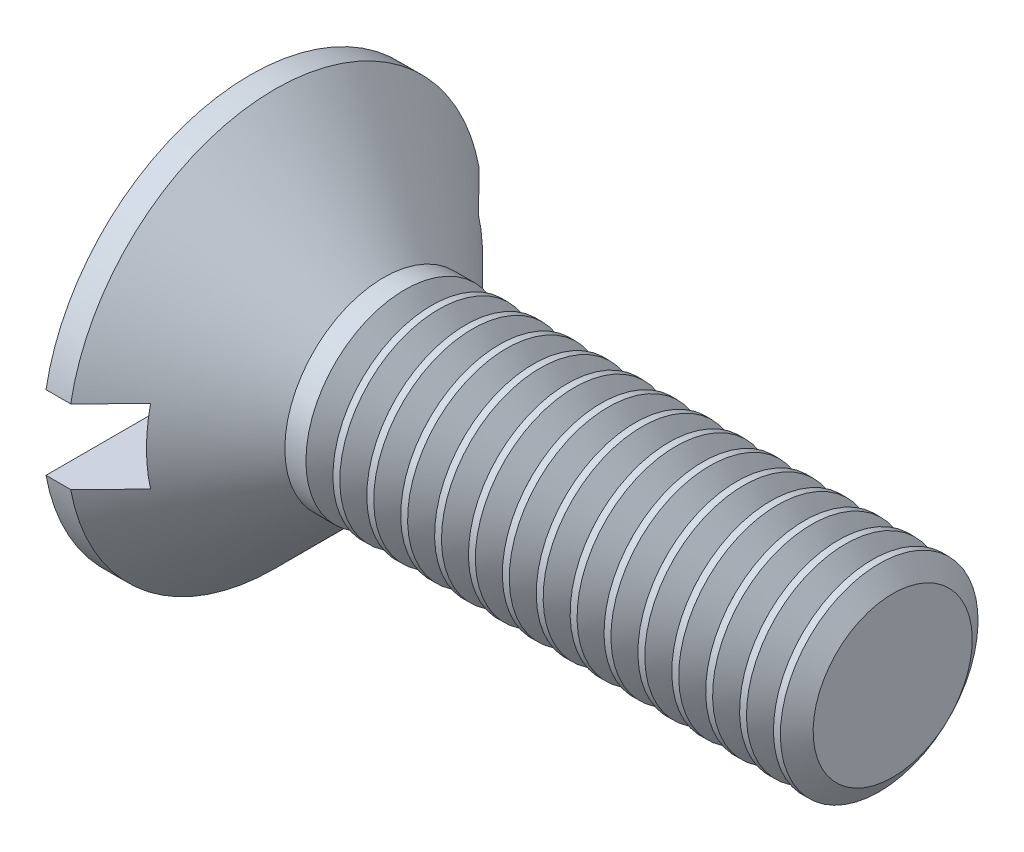
from build123d import *

# Parameters (mm, degrees)
SKETCH2_W       = 8.4
SKETCH2_H       = 1.5
SLOT_DEPTH      = 1.3
THDSCHPAT_COUNT = 15
THDSCHPAT_PITCH = 0.685714286


with BuildPart() as part:
    # BodySke → Base-Revolve (revolve)
    with BuildSketch(Plane.XY, mode=Mode.PRIVATE) as base_revolve_sk:
        Polygon((0, 0), (0, 4.2), (0.5, 4.2), (2.7, 2), (13, 2), (13, 0), align=None)
    revolve(base_revolve_sk.sketch.rotate(Axis((-6.35, 0, 0), (1, 0, 0)), 90), axis=Axis((-6.35, 0, 0), (1, 0, 0)))

    # Sketch2 → Slot (cut)
    with BuildSketch(Plane.ZY):
        Rectangle(SKETCH2_W, SKETCH2_H)
    extrude(amount=-SLOT_DEPTH, mode=Mode.SUBTRACT)

    # ThdSchSke → ThreadSchematic (revolve, cut)
    with BuildSketch(Plane.XY):
        Polygon((3.400001, -1.61), (3.12692006, -2), (3.12692006, -2.5), (3.67308194, -2.5), (3.67308194, -2), align=None)
    threadschematic = revolve(axis=Axis((-3.175, 0, 0), (1, 0, 0)), mode=Mode.SUBTRACT)

    # ThdSchPat: ThreadSchematic ×15
    with Locations(*[(i * THDSCHPAT_PITCH, 0, 0) for i in range(1, THDSCHPAT_COUNT)]):
        add(threadschematic, mode=Mode.SUBTRACT)


solid = part.part
